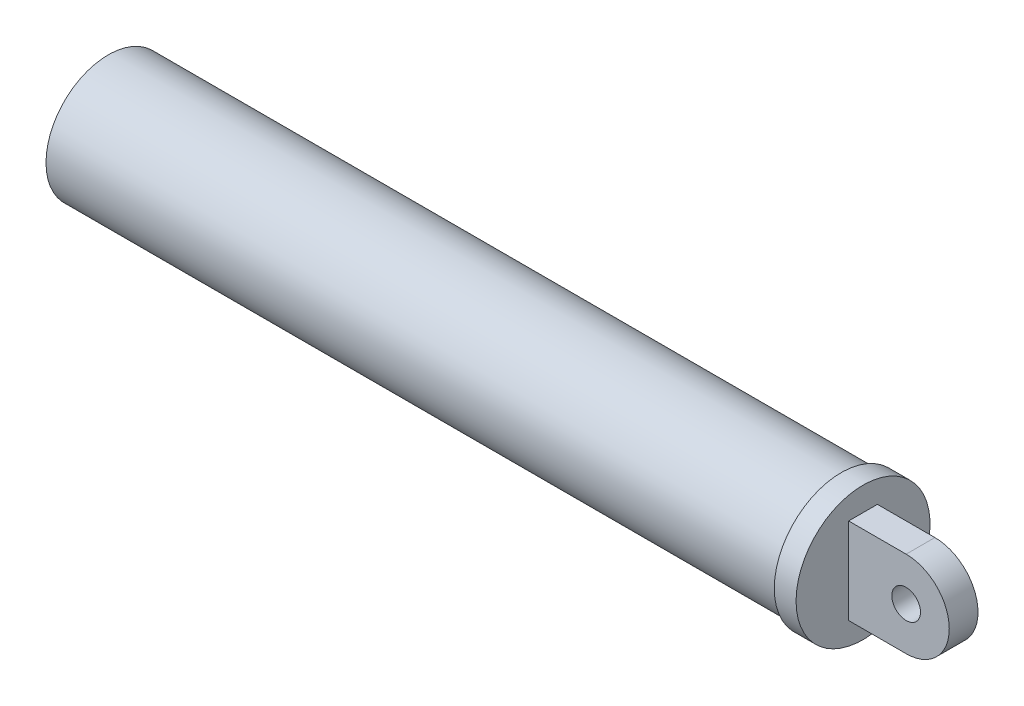
from build123d import *

# Parameters (mm, degrees)
SKETCH1_R           = 4.993252943
BOSS_EXTRUDE2_DEPTH = 5


with BuildPart() as part:
    # Sketch1 → Boss-Extrude2 (new, symmetric)
    with BuildSketch(Plane.XY):
        with BuildLine():
            Line((299.568188368, 38.981558344), (319.568188368, 38.981558344))
            ThreePointArc((319.568188368, 38.981558344), (334.568188368, 23.981558344), (319.568188368, 8.981558344))
            Line((319.568188368, 8.981558344), (299.568188368, 8.981558344))
            Line((299.568188368, 8.981558344), (299.568188368, 38.981558344))
        make_face()
        with Locations((319.568188368, 23.981558344)):
            Circle(SKETCH1_R, mode=Mode.SUBTRACT)
    extrude(amount=BOSS_EXTRUDE2_DEPTH, both=True)

    # Sketch3 → Revolve3 (revolve)
    with BuildSketch(Plane.XY, mode=Mode.PRIVATE) as revolve3_sk:
        Polygon((291.998587327, 45.654710618), (291.998587327, 47.281219247), (299.568188368, 47.281219247), (299.568188368, 38.981558344), (299.568188368, 23.981558344), (286.998587327, 23.981558344), (286.998587327, 39.61078701), (36.998587327, 39.61078701), (36.998587327, 45.654710618), align=None)
    revolve(revolve3_sk.sketch.rotate(Axis((286.998587327, 23.981558344, 0), (1, 0, 0)), 90), axis=Axis((286.998587327, 23.981558344, 0), (1, 0, 0)))


solid = part.part
